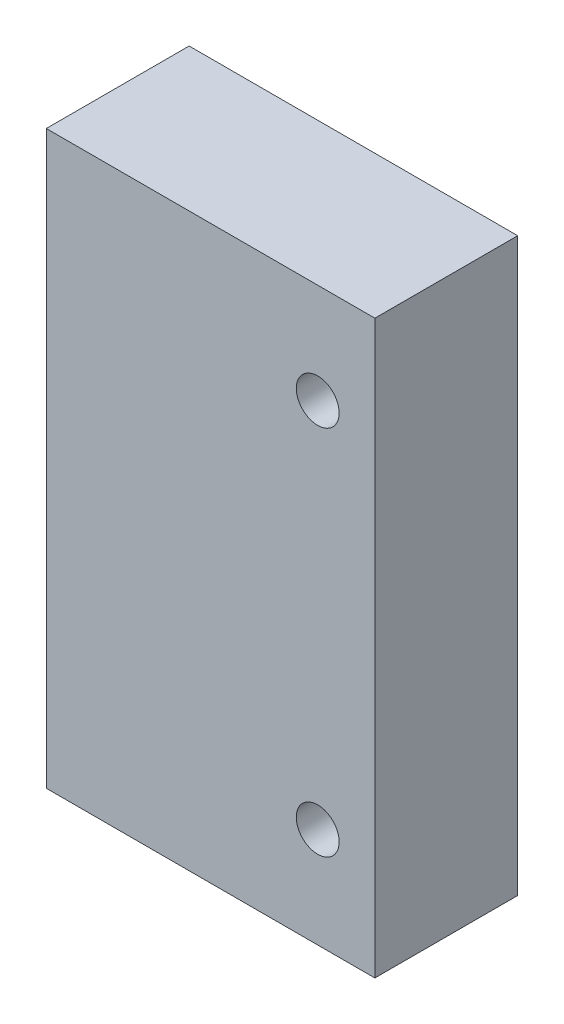
from build123d import *

# Parameters (mm, degrees)
SKETCH_1_W      = 23
SKETCH_1_H      = 40
SKETCH_1_R      = 1.5
EXTRUDE_1_DEPTH = 10


with BuildPart() as part:
    # 草图1 → 凸台-拉伸1 (new body)
    with BuildSketch(Plane.XY):
        Rectangle(SKETCH_1_W, SKETCH_1_H)
        with Locations((7.5, 13)):
            Circle(SKETCH_1_R, mode=Mode.SUBTRACT)
        with Locations((7.5, -13)):
            Circle(SKETCH_1_R, mode=Mode.SUBTRACT)
    extrude(amount=EXTRUDE_1_DEPTH)


solid = part.part
